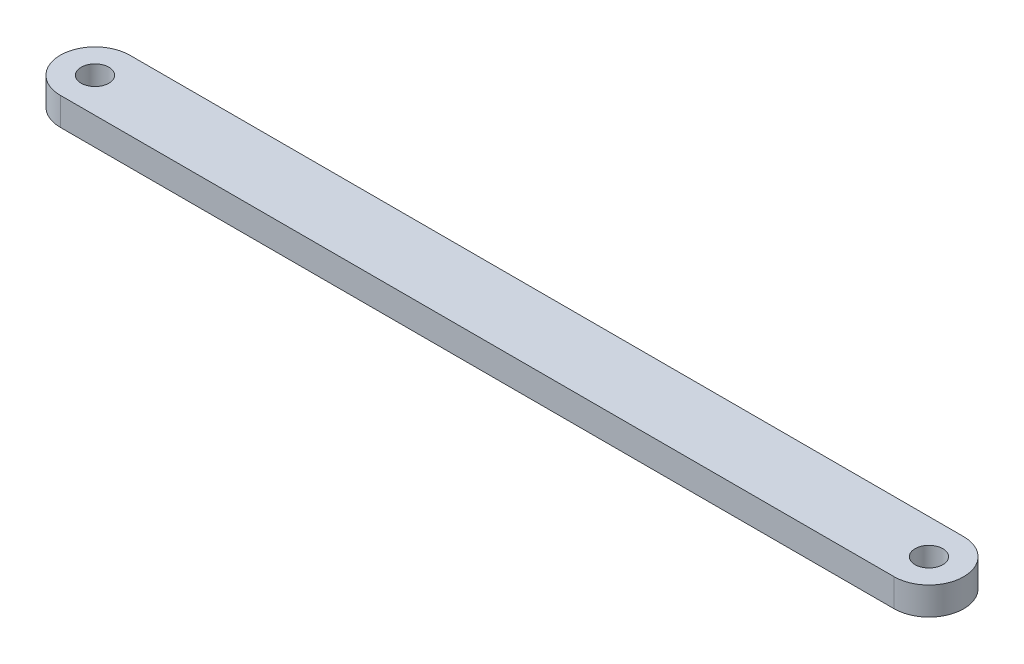
from build123d import *

# Parameters (mm, degrees)
SKETCH1_R           = 1
BOSS_EXTRUDE1_DEPTH = 2


with BuildPart() as part:
    # Sketch1 → Boss-Extrude1 (new body)
    with BuildSketch(Plane(origin=(0, 0, 0), x_dir=(1, 0, 0), z_dir=(0, 1, 0))):
        with BuildLine():
            Line((-10, 2.5), (50, 2.5))
            ThreePointArc((50, 2.5), (52.5, 0), (50, -2.5))
            Line((50, -2.5), (-10, -2.5))
            ThreePointArc((-10, -2.5), (-12.5, 0), (-10, 2.5))
        make_face()
        with Locations(Location((50, 0, 0), (0, 0, 270))):
            Circle(SKETCH1_R, mode=Mode.SUBTRACT)
        with Locations(Location((-10, 0, 0), (0, 0, 270))):
            Circle(SKETCH1_R, mode=Mode.SUBTRACT)
    extrude(amount=BOSS_EXTRUDE1_DEPTH)


solid = part.part
